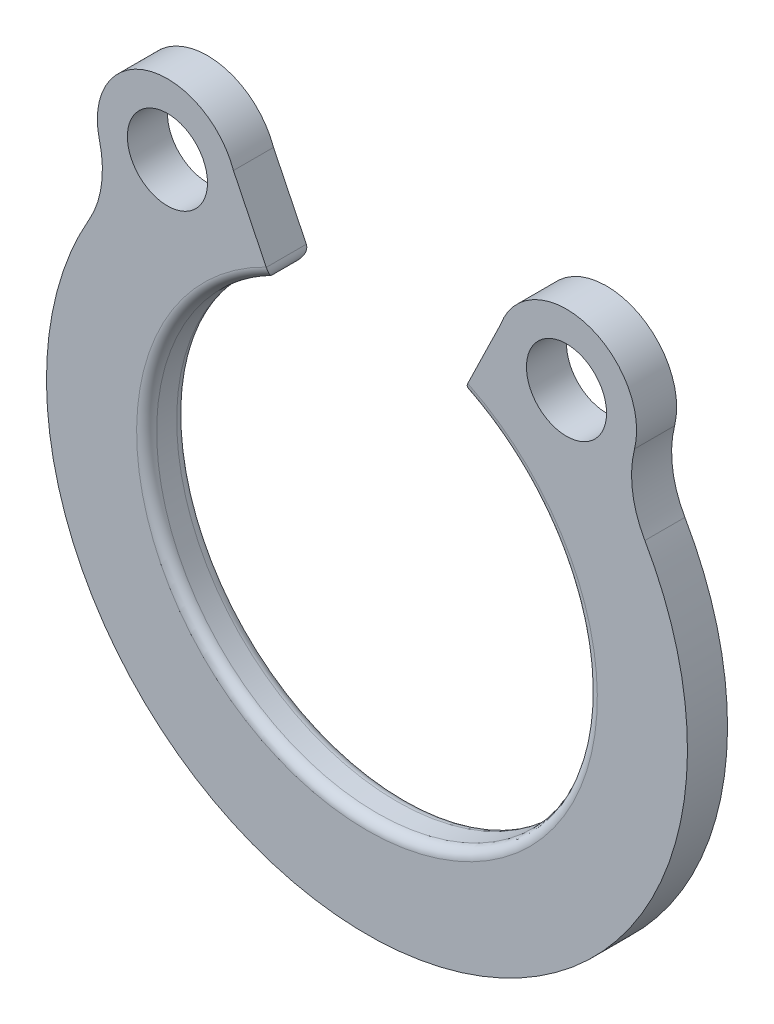
from build123d import *

# Parameters (mm, degrees)
BOSS_EXTRUDE1_DEPTH      = 0.5
BOSS_EXTRUDE1_DEPTH_BACK = 0.5
BOSS_EXTRUDE2_START      = -0.5
SKETCH2_R                = 1.75
SKETCH2_R_2              = 1
BOSS_EXTRUDE2_DEPTH      = 1
FILLET1_R                = 2.5
CUT_EXTRUDE1_DEPTH       = 12.332242011
CUT_EXTRUDE1_DEPTH_BACK  = 12.332242011
SKETCH2_2_R              = 1
FILLET4_R                = 0.25


with BuildPart() as part:
    # Sketch1 → Boss-Extrude1 (new, two sides: drawn at the far end of the back side and taken through both)
    with BuildSketch(Plane.XY.offset(-BOSS_EXTRUDE1_DEPTH_BACK)):
        with BuildLine():
            ThreePointArc((8, 0), (6.782329983, 4.242640687), (3.5, 7.193747285))
            Line((3.5, 7.193747285), (2.40625, 4.945701258))
            ThreePointArc((2.40625, 4.945701258), (4.662851863, 2.916815472), (5.5, 0))
            ThreePointArc((5.5, 0), (-2.916815472, -4.662851863), (-2.40625, 4.945701258))
            Line((-2.40625, 4.945701258), (-3.5, 7.193747285))
            ThreePointArc((-3.5, 7.193747285), (-4.242640687, -6.782329983), (8, 0))
        make_face()
    extrude(amount=BOSS_EXTRUDE1_DEPTH + BOSS_EXTRUDE1_DEPTH_BACK)

    # Sketch2 → Boss-Extrude2 (add)
    # profile 1 of 2: a face of its own
    with BuildSketch(Plane.XY.offset(BOSS_EXTRUDE2_START)):
        with Locations((-4.980451069, 6.260599584)):
            Circle(SKETCH2_R)
        with Locations((-4.980451069, 6.260599584)):
            Circle(SKETCH2_R_2, mode=Mode.SUBTRACT)
    # profile 2 of 2: a face of its own
    with BuildSketch(Plane.XY.offset(BOSS_EXTRUDE2_START)):
        with Locations((4.980451069, 6.260599584)):
            Circle(SKETCH2_R)
        with Locations((4.980451069, 6.260599584)):
            Circle(SKETCH2_R_2, mode=Mode.SUBTRACT)
    extrude(amount=BOSS_EXTRUDE2_DEPTH)

    # Fillet1
    fillet1_edges = [part.edges().sort_by_distance(p)[0] for p in [
        (-6.222579772, 5.02787241, 0),
        (6.222579772, 5.02787241, 0),
    ]]
    fillet(fillet1_edges, radius=FILLET1_R)

    # Sketch2<2> → Cut-Extrude1 (cut, two sides: drawn at the far end of the back side and taken through both)
    with BuildSketch(Plane.XY.offset(-CUT_EXTRUDE1_DEPTH_BACK)):
        with Locations((-4.980451069, 6.260599584)):
            Circle(SKETCH2_2_R)
        with Locations((4.980451069, 6.260599584)):
            Circle(SKETCH2_2_R)
    extrude(amount=CUT_EXTRUDE1_DEPTH + CUT_EXTRUDE1_DEPTH_BACK, mode=Mode.SUBTRACT)

    # Fillet4
    fillet4_edges = [part.edges().sort_by_distance(p)[0] for p in [
        (0, -5.5, 0.5),
        (0, -5.5, -0.5),
        (2.40625, 4.945701258, 0),
        (-2.40625, 4.945701258, 0),
    ]]
    fillet(fillet4_edges, radius=FILLET4_R)


solid = part.part
